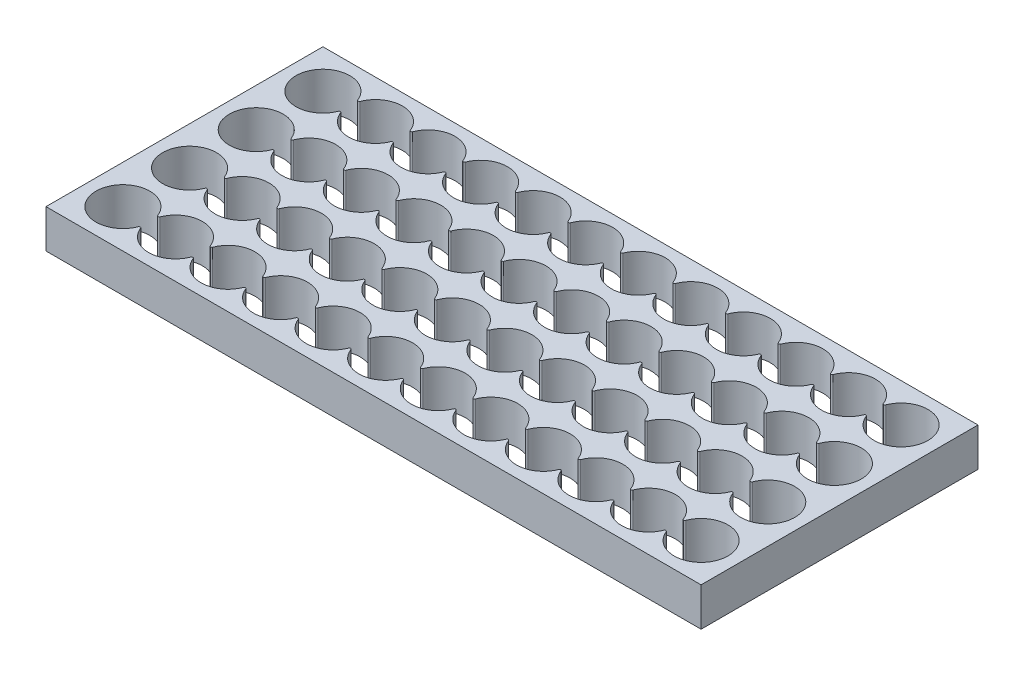
from build123d import *

# Parameters (mm, degrees)
BOSS_EXTRUDE1_DEPTH = 7.5


with BuildPart() as part:
    # Sketch1 → Boss-Extrude1 (new, symmetric)
    with BuildSketch(Plane(origin=(0, 0, 0), x_dir=(1, 0, 0), z_dir=(0, 1, 0))):
        Polygon((-15, -13), (-15, 13), (-15, 65), (-15, 93), (240.5, 93), (240.5, 39), (240.5, -13), (240.5, -15), (-15, -15), align=None)
        with BuildLine():
            ThreePointArc((9.784090909, 3.810717135), (-10.5, 0), (9.784090909, -3.810717135))
            ThreePointArc((9.784090909, -3.810717135), (10.25, -3.492179856), (10.715909091, -3.810717135))
            ThreePointArc((10.715909091, -3.810717135), (20.5, -10.5), (30.284090909, -3.810717135))
            ThreePointArc((30.284090909, -3.810717135), (30.75, -3.492179856), (31.215909091, -3.810717135))
            ThreePointArc((31.215909091, -3.810717135), (41, -10.5), (50.784090909, -3.810717135))
            ThreePointArc((50.784090909, -3.810717135), (51.25, -3.492179856), (51.715909091, -3.810717135))
            ThreePointArc((51.715909091, -3.810717135), (61.5, -10.5), (71.284090909, -3.810717135))
            ThreePointArc((71.284090909, -3.810717135), (71.75, -3.492179856), (72.215909091, -3.810717135))
            ThreePointArc((72.215909091, -3.810717135), (82, -10.5), (91.784090909, -3.810717135))
            ThreePointArc((91.784090909, -3.810717135), (92.25, -3.492179856), (92.715909091, -3.810717135))
            ThreePointArc((92.715909091, -3.810717135), (102.5, -10.5), (112.284090909, -3.810717135))
            ThreePointArc((112.284090909, -3.810717135), (112.75, -3.492179856), (113.215909091, -3.810717135))
            ThreePointArc((113.215909091, -3.810717135), (123, -10.5), (132.784090909, -3.810717135))
            ThreePointArc((132.784090909, -3.810717135), (133.25, -3.492179856), (133.715909091, -3.810717135))
            ThreePointArc((133.715909091, -3.810717135), (143.5, -10.5), (153.284090909, -3.810717135))
            ThreePointArc((153.284090909, -3.810717135), (153.75, -3.492179856), (154.215909091, -3.810717135))
            ThreePointArc((154.215909091, -3.810717135), (164, -10.5), (173.784090909, -3.810717135))
            ThreePointArc((173.784090909, -3.810717135), (174.25, -3.492179856), (174.715909091, -3.810717135))
            ThreePointArc((174.715909091, -3.810717135), (184.5, -10.5), (194.284090909, -3.810717135))
            ThreePointArc((194.284090909, -3.810717135), (194.75, -3.492179856), (195.215909091, -3.810717135))
            ThreePointArc((195.215909091, -3.810717135), (205, -10.5), (214.784090909, -3.810717135))
            ThreePointArc((214.784090909, -3.810717135), (215.25, -3.492179856), (215.715909091, -3.810717135))
            ThreePointArc((215.715909091, -3.810717135), (236, 0), (215.715909091, 3.810717135))
            ThreePointArc((215.715909091, 3.810717135), (215.25, 3.492179856), (214.784090909, 3.810717135))
            ThreePointArc((214.784090909, 3.810717135), (205, 10.5), (195.215909091, 3.810717135))
            ThreePointArc((195.215909091, 3.810717135), (194.75, 3.492179856), (194.284090909, 3.810717135))
            ThreePointArc((194.284090909, 3.810717135), (184.5, 10.5), (174.715909091, 3.810717135))
            ThreePointArc((174.715909091, 3.810717135), (174.25, 3.492179856), (173.784090909, 3.810717135))
            ThreePointArc((173.784090909, 3.810717135), (164, 10.5), (154.215909091, 3.810717135))
            ThreePointArc((154.215909091, 3.810717135), (153.75, 3.492179856), (153.284090909, 3.810717135))
            ThreePointArc((153.284090909, 3.810717135), (143.5, 10.5), (133.715909091, 3.810717135))
            ThreePointArc((133.715909091, 3.810717135), (133.25, 3.492179856), (132.784090909, 3.810717135))
            ThreePointArc((132.784090909, 3.810717135), (123, 10.5), (113.215909091, 3.810717135))
            ThreePointArc((113.215909091, 3.810717135), (112.75, 3.492179856), (112.284090909, 3.810717135))
            ThreePointArc((112.284090909, 3.810717135), (102.5, 10.5), (92.715909091, 3.810717135))
            ThreePointArc((92.715909091, 3.810717135), (92.25, 3.492179856), (91.784090909, 3.810717135))
            ThreePointArc((91.784090909, 3.810717135), (82, 10.5), (72.215909091, 3.810717135))
            ThreePointArc((72.215909091, 3.810717135), (71.75, 3.492179856), (71.284090909, 3.810717135))
            ThreePointArc((71.284090909, 3.810717135), (61.5, 10.5), (51.715909091, 3.810717135))
            ThreePointArc((51.715909091, 3.810717135), (51.25, 3.492179856), (50.784090909, 3.810717135))
            ThreePointArc((50.784090909, 3.810717135), (41, 10.5), (31.215909091, 3.810717135))
            ThreePointArc((31.215909091, 3.810717135), (30.75, 3.492179856), (30.284090909, 3.810717135))
            ThreePointArc((30.284090909, 3.810717135), (20.5, 10.5), (10.715909091, 3.810717135))
            ThreePointArc((10.715909091, 3.810717135), (10.25, 3.492179856), (9.784090909, 3.810717135))
        make_face(mode=Mode.SUBTRACT)
        with BuildLine():
            ThreePointArc((31.215909091, 22.189282865), (30.75, 22.507820144), (30.284090909, 22.189282865))
            ThreePointArc((30.284090909, 22.189282865), (20.5, 15.5), (10.715909091, 22.189282865))
            ThreePointArc((10.715909091, 22.189282865), (10.25, 22.507820144), (9.784090909, 22.189282865))
            ThreePointArc((9.784090909, 22.189282865), (-10.5, 26), (9.784090909, 29.810717135))
            ThreePointArc((9.784090909, 29.810717135), (10.25, 29.492179856), (10.715909091, 29.810717135))
            ThreePointArc((10.715909091, 29.810717135), (20.5, 36.5), (30.284090909, 29.810717135))
            ThreePointArc((30.284090909, 29.810717135), (30.75, 29.492179856), (31.215909091, 29.810717135))
            ThreePointArc((31.215909091, 29.810717135), (41, 36.5), (50.784090909, 29.810717135))
            ThreePointArc((50.784090909, 29.810717135), (51.25, 29.492179856), (51.715909091, 29.810717135))
            ThreePointArc((51.715909091, 29.810717135), (61.5, 36.5), (71.284090909, 29.810717135))
            ThreePointArc((71.284090909, 29.810717135), (71.75, 29.492179856), (72.215909091, 29.810717135))
            ThreePointArc((72.215909091, 29.810717135), (82, 36.5), (91.784090909, 29.810717135))
            ThreePointArc((91.784090909, 29.810717135), (92.25, 29.492179856), (92.715909091, 29.810717135))
            ThreePointArc((92.715909091, 29.810717135), (102.5, 36.5), (112.284090909, 29.810717135))
            ThreePointArc((112.284090909, 29.810717135), (112.75, 29.492179856), (113.215909091, 29.810717135))
            ThreePointArc((113.215909091, 29.810717135), (123, 36.5), (132.784090909, 29.810717135))
            ThreePointArc((132.784090909, 29.810717135), (133.25, 29.492179856), (133.715909091, 29.810717135))
            ThreePointArc((133.715909091, 29.810717135), (143.5, 36.5), (153.284090909, 29.810717135))
            ThreePointArc((153.284090909, 29.810717135), (153.75, 29.492179856), (154.215909091, 29.810717135))
            ThreePointArc((154.215909091, 29.810717135), (164, 36.5), (173.784090909, 29.810717135))
            ThreePointArc((173.784090909, 29.810717135), (174.25, 29.492179856), (174.715909091, 29.810717135))
            ThreePointArc((174.715909091, 29.810717135), (184.5, 36.5), (194.284090909, 29.810717135))
            ThreePointArc((194.284090909, 29.810717135), (194.75, 29.492179856), (195.215909091, 29.810717135))
            ThreePointArc((195.215909091, 29.810717135), (205, 36.5), (214.784090909, 29.810717135))
            ThreePointArc((214.784090909, 29.810717135), (215.25, 29.492179856), (215.715909091, 29.810717135))
            ThreePointArc((215.715909091, 29.810717135), (236, 26), (215.715909091, 22.189282865))
            ThreePointArc((215.715909091, 22.189282865), (215.25, 22.507820144), (214.784090909, 22.189282865))
            ThreePointArc((214.784090909, 22.189282865), (205, 15.5), (195.215909091, 22.189282865))
            ThreePointArc((195.215909091, 22.189282865), (194.75, 22.507820144), (194.284090909, 22.189282865))
            ThreePointArc((194.284090909, 22.189282865), (184.5, 15.5), (174.715909091, 22.189282865))
            ThreePointArc((174.715909091, 22.189282865), (174.25, 22.507820144), (173.784090909, 22.189282865))
            ThreePointArc((173.784090909, 22.189282865), (164, 15.5), (154.215909091, 22.189282865))
            ThreePointArc((154.215909091, 22.189282865), (153.75, 22.507820144), (153.284090909, 22.189282865))
            ThreePointArc((153.284090909, 22.189282865), (143.5, 15.5), (133.715909091, 22.189282865))
            ThreePointArc((133.715909091, 22.189282865), (133.25, 22.507820144), (132.784090909, 22.189282865))
            ThreePointArc((132.784090909, 22.189282865), (123, 15.5), (113.215909091, 22.189282865))
            ThreePointArc((113.215909091, 22.189282865), (112.75, 22.507820144), (112.284090909, 22.189282865))
            ThreePointArc((112.284090909, 22.189282865), (102.5, 15.5), (92.715909091, 22.189282865))
            ThreePointArc((92.715909091, 22.189282865), (92.25, 22.507820144), (91.784090909, 22.189282865))
            ThreePointArc((91.784090909, 22.189282865), (82, 15.5), (72.215909091, 22.189282865))
            ThreePointArc((72.215909091, 22.189282865), (71.75, 22.507820144), (71.284090909, 22.189282865))
            ThreePointArc((71.284090909, 22.189282865), (61.5, 15.5), (51.715909091, 22.189282865))
            ThreePointArc((51.715909091, 22.189282865), (51.25, 22.507820144), (50.784090909, 22.189282865))
            ThreePointArc((50.784090909, 22.189282865), (41, 15.5), (31.215909091, 22.189282865))
        make_face(mode=Mode.SUBTRACT)
        with BuildLine():
            ThreePointArc((9.784090909, 55.810717135), (-10.5, 52), (9.784090909, 48.189282865))
            ThreePointArc((9.784090909, 48.189282865), (10.25, 48.507820144), (10.715909091, 48.189282865))
            ThreePointArc((10.715909091, 48.189282865), (20.5, 41.5), (30.284090909, 48.189282865))
            ThreePointArc((30.284090909, 48.189282865), (30.75, 48.507820144), (31.215909091, 48.189282865))
            ThreePointArc((31.215909091, 48.189282865), (41, 41.5), (50.784090909, 48.189282865))
            ThreePointArc((50.784090909, 48.189282865), (51.25, 48.507820144), (51.715909091, 48.189282865))
            ThreePointArc((51.715909091, 48.189282865), (61.5, 41.5), (71.284090909, 48.189282865))
            ThreePointArc((71.284090909, 48.189282865), (71.75, 48.507820144), (72.215909091, 48.189282865))
            ThreePointArc((72.215909091, 48.189282865), (82, 41.5), (91.784090909, 48.189282865))
            ThreePointArc((91.784090909, 48.189282865), (92.25, 48.507820144), (92.715909091, 48.189282865))
            ThreePointArc((92.715909091, 48.189282865), (102.5, 41.5), (112.284090909, 48.189282865))
            ThreePointArc((112.284090909, 48.189282865), (112.75, 48.507820144), (113.215909091, 48.189282865))
            ThreePointArc((113.215909091, 48.189282865), (123, 41.5), (132.784090909, 48.189282865))
            ThreePointArc((132.784090909, 48.189282865), (133.25, 48.507820144), (133.715909091, 48.189282865))
            ThreePointArc((133.715909091, 48.189282865), (143.5, 41.5), (153.284090909, 48.189282865))
            ThreePointArc((153.284090909, 48.189282865), (153.75, 48.507820144), (154.215909091, 48.189282865))
            ThreePointArc((154.215909091, 48.189282865), (164, 41.5), (173.784090909, 48.189282865))
            ThreePointArc((173.784090909, 48.189282865), (174.25, 48.507820144), (174.715909091, 48.189282865))
            ThreePointArc((174.715909091, 48.189282865), (184.5, 41.5), (194.284090909, 48.189282865))
            ThreePointArc((194.284090909, 48.189282865), (194.75, 48.507820144), (195.215909091, 48.189282865))
            ThreePointArc((195.215909091, 48.189282865), (205, 41.5), (214.784090909, 48.189282865))
            ThreePointArc((214.784090909, 48.189282865), (215.25, 48.507820144), (215.715909091, 48.189282865))
            ThreePointArc((215.715909091, 48.189282865), (236, 52), (215.715909091, 55.810717135))
            ThreePointArc((215.715909091, 55.810717135), (215.25, 55.492179856), (214.784090909, 55.810717135))
            ThreePointArc((214.784090909, 55.810717135), (205, 62.5), (195.215909091, 55.810717135))
            ThreePointArc((195.215909091, 55.810717135), (194.75, 55.492179856), (194.284090909, 55.810717135))
            ThreePointArc((194.284090909, 55.810717135), (184.5, 62.5), (174.715909091, 55.810717135))
            ThreePointArc((174.715909091, 55.810717135), (174.25, 55.492179856), (173.784090909, 55.810717135))
            ThreePointArc((173.784090909, 55.810717135), (164, 62.5), (154.215909091, 55.810717135))
            ThreePointArc((154.215909091, 55.810717135), (153.75, 55.492179856), (153.284090909, 55.810717135))
            ThreePointArc((153.284090909, 55.810717135), (143.5, 62.5), (133.715909091, 55.810717135))
            ThreePointArc((133.715909091, 55.810717135), (133.25, 55.492179856), (132.784090909, 55.810717135))
            ThreePointArc((132.784090909, 55.810717135), (123, 62.5), (113.215909091, 55.810717135))
            ThreePointArc((113.215909091, 55.810717135), (112.75, 55.492179856), (112.284090909, 55.810717135))
            ThreePointArc((112.284090909, 55.810717135), (102.5, 62.5), (92.715909091, 55.810717135))
            ThreePointArc((92.715909091, 55.810717135), (92.25, 55.492179856), (91.784090909, 55.810717135))
            ThreePointArc((91.784090909, 55.810717135), (82, 62.5), (72.215909091, 55.810717135))
            ThreePointArc((72.215909091, 55.810717135), (71.75, 55.492179856), (71.284090909, 55.810717135))
            ThreePointArc((71.284090909, 55.810717135), (61.5, 62.5), (51.715909091, 55.810717135))
            ThreePointArc((51.715909091, 55.810717135), (51.25, 55.492179856), (50.784090909, 55.810717135))
            ThreePointArc((50.784090909, 55.810717135), (41, 62.5), (31.215909091, 55.810717135))
            ThreePointArc((31.215909091, 55.810717135), (30.75, 55.492179856), (30.284090909, 55.810717135))
            ThreePointArc((30.284090909, 55.810717135), (20.5, 62.5), (10.715909091, 55.810717135))
            ThreePointArc((10.715909091, 55.810717135), (10.25, 55.492179856), (9.784090909, 55.810717135))
        make_face(mode=Mode.SUBTRACT)
        with BuildLine():
            ThreePointArc((31.215909091, 74.189282865), (30.75, 74.507820144), (30.284090909, 74.189282865))
            ThreePointArc((30.284090909, 74.189282865), (20.5, 67.5), (10.715909091, 74.189282865))
            ThreePointArc((10.715909091, 74.189282865), (10.25, 74.507820144), (9.784090909, 74.189282865))
            ThreePointArc((9.784090909, 74.189282865), (-10.5, 78), (9.784090909, 81.810717135))
            ThreePointArc((9.784090909, 81.810717135), (10.25, 81.492179856), (10.715909091, 81.810717135))
            ThreePointArc((10.715909091, 81.810717135), (20.5, 88.5), (30.284090909, 81.810717135))
            ThreePointArc((30.284090909, 81.810717135), (30.75, 81.492179856), (31.215909091, 81.810717135))
            ThreePointArc((31.215909091, 81.810717135), (41, 88.5), (50.784090909, 81.810717135))
            ThreePointArc((50.784090909, 81.810717135), (51.25, 81.492179856), (51.715909091, 81.810717135))
            ThreePointArc((51.715909091, 81.810717135), (61.5, 88.5), (71.284090909, 81.810717135))
            ThreePointArc((71.284090909, 81.810717135), (71.75, 81.492179856), (72.215909091, 81.810717135))
            ThreePointArc((72.215909091, 81.810717135), (82, 88.5), (91.784090909, 81.810717135))
            ThreePointArc((91.784090909, 81.810717135), (92.25, 81.492179856), (92.715909091, 81.810717135))
            ThreePointArc((92.715909091, 81.810717135), (102.5, 88.5), (112.284090909, 81.810717135))
            ThreePointArc((112.284090909, 81.810717135), (112.75, 81.492179856), (113.215909091, 81.810717135))
            ThreePointArc((113.215909091, 81.810717135), (123, 88.5), (132.784090909, 81.810717135))
            ThreePointArc((132.784090909, 81.810717135), (133.25, 81.492179856), (133.715909091, 81.810717135))
            ThreePointArc((133.715909091, 81.810717135), (143.5, 88.5), (153.284090909, 81.810717135))
            ThreePointArc((153.284090909, 81.810717135), (153.75, 81.492179856), (154.215909091, 81.810717135))
            ThreePointArc((154.215909091, 81.810717135), (164, 88.5), (173.784090909, 81.810717135))
            ThreePointArc((173.784090909, 81.810717135), (174.25, 81.492179856), (174.715909091, 81.810717135))
            ThreePointArc((174.715909091, 81.810717135), (184.5, 88.5), (194.284090909, 81.810717135))
            ThreePointArc((194.284090909, 81.810717135), (194.75, 81.492179856), (195.215909091, 81.810717135))
            ThreePointArc((195.215909091, 81.810717135), (205, 88.5), (214.784090909, 81.810717135))
            ThreePointArc((214.784090909, 81.810717135), (215.25, 81.492179856), (215.715909091, 81.810717135))
            ThreePointArc((215.715909091, 81.810717135), (236, 78), (215.715909091, 74.189282865))
            ThreePointArc((215.715909091, 74.189282865), (215.25, 74.507820144), (214.784090909, 74.189282865))
            ThreePointArc((214.784090909, 74.189282865), (205, 67.5), (195.215909091, 74.189282865))
            ThreePointArc((195.215909091, 74.189282865), (194.75, 74.507820144), (194.284090909, 74.189282865))
            ThreePointArc((194.284090909, 74.189282865), (184.5, 67.5), (174.715909091, 74.189282865))
            ThreePointArc((174.715909091, 74.189282865), (174.25, 74.507820144), (173.784090909, 74.189282865))
            ThreePointArc((173.784090909, 74.189282865), (164, 67.5), (154.215909091, 74.189282865))
            ThreePointArc((154.215909091, 74.189282865), (153.75, 74.507820144), (153.284090909, 74.189282865))
            ThreePointArc((153.284090909, 74.189282865), (143.5, 67.5), (133.715909091, 74.189282865))
            ThreePointArc((133.715909091, 74.189282865), (133.25, 74.507820144), (132.784090909, 74.189282865))
            ThreePointArc((132.784090909, 74.189282865), (123, 67.5), (113.215909091, 74.189282865))
            ThreePointArc((113.215909091, 74.189282865), (112.75, 74.507820144), (112.284090909, 74.189282865))
            ThreePointArc((112.284090909, 74.189282865), (102.5, 67.5), (92.715909091, 74.189282865))
            ThreePointArc((92.715909091, 74.189282865), (92.25, 74.507820144), (91.784090909, 74.189282865))
            ThreePointArc((91.784090909, 74.189282865), (82, 67.5), (72.215909091, 74.189282865))
            ThreePointArc((72.215909091, 74.189282865), (71.75, 74.507820144), (71.284090909, 74.189282865))
            ThreePointArc((71.284090909, 74.189282865), (61.5, 67.5), (51.715909091, 74.189282865))
            ThreePointArc((51.715909091, 74.189282865), (51.25, 74.507820144), (50.784090909, 74.189282865))
            ThreePointArc((50.784090909, 74.189282865), (41, 67.5), (31.215909091, 74.189282865))
        make_face(mode=Mode.SUBTRACT)
    extrude(amount=BOSS_EXTRUDE1_DEPTH, both=True)


solid = part.part
